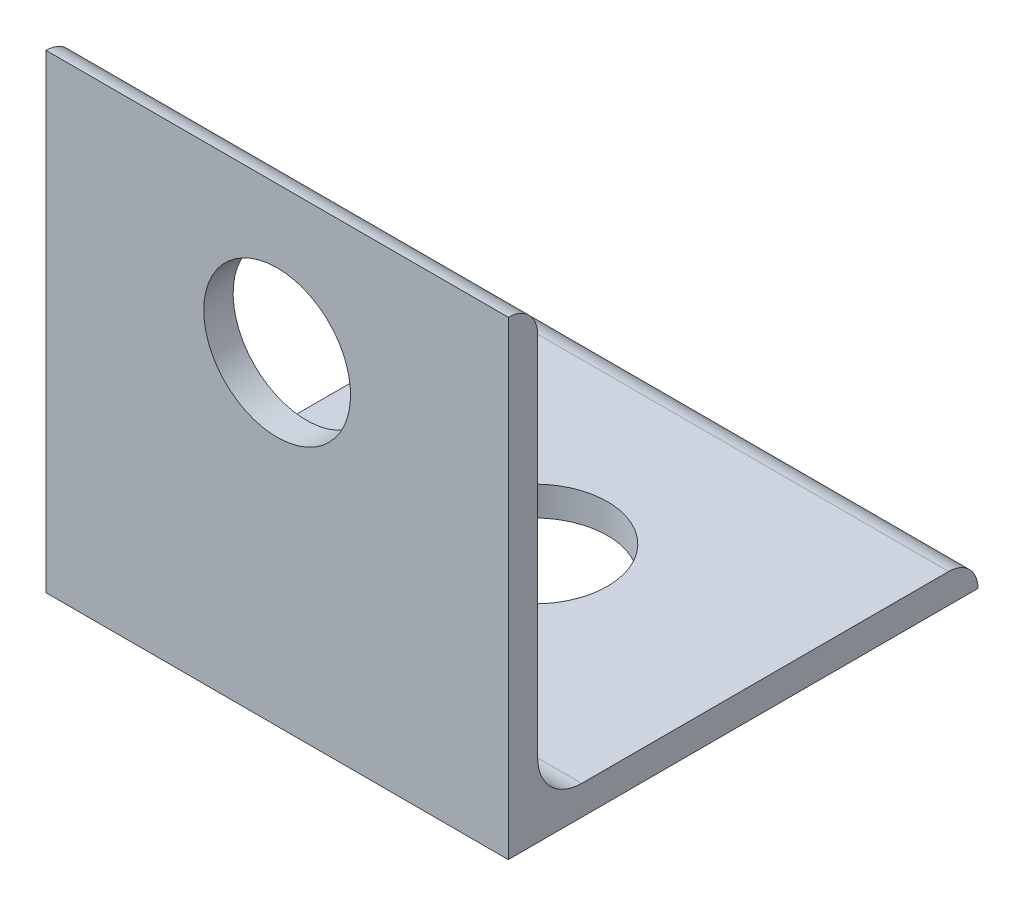
from build123d import *

# Parameters (mm, degrees)
ANGLE_IRON_2_X_2_X_0_125_1_DEPTH = 50
SKETCH4_R                        = 7.9375
CUT_EXTRUDE1_DEPTH               = 3.175
SKETCH3_R                        = 7.9375
CUT_EXTRUDE2_DEPTH               = 3.175


with BuildPart() as part:
    # Sketch1 → Angle iron 2 X 2 X 0.125(1) (new body)
    with BuildSketch(Plane(origin=(0, 0, 0), x_dir=(0, 0, -1), z_dir=(1, 0, 0))):
        with BuildLine():
            Line((0, 0), (0, 50.8))
            Line((0, 50.8), (0.00508, 50.8))
            ThreePointArc((0.00508, 50.8), (2.246551928, 49.871551928), (3.175, 47.63008))
            Line((3.175, 47.63008), (3.175, 7.9375))
            ThreePointArc((3.175, 7.9375), (4.569903955, 4.569903955), (7.9375, 3.175))
            Line((7.9375, 3.175), (47.63008, 3.175))
            ThreePointArc((47.63008, 3.175), (49.871551928, 2.246551928), (50.8, 0.00508))
            Line((50.8, 0.00508), (50.8, 0))
            Line((50.8, 0), (0, 0))
        make_face()
    extrude(amount=ANGLE_IRON_2_X_2_X_0_125_1_DEPTH)

    # Sketch4 → Cut-Extrude1 (cut)
    with BuildSketch(Plane(origin=(0, 3.175, 0), x_dir=(1, 0, 0), z_dir=(0, 1, 0))):
        with Locations(Location((25, 27.78379, 0), (0, 0, 270))):
            Circle(SKETCH4_R)
    extrude(amount=-CUT_EXTRUDE1_DEPTH, mode=Mode.SUBTRACT)

    # Sketch3 → Cut-Extrude2 (cut)
    with BuildSketch(Plane(origin=(0, 0, -3.175), x_dir=(-1, 0, 0), z_dir=(0, 0, -1))):
        with Locations(Location((-25, 34.9975, 0), (0, 0, 90))):
            Circle(SKETCH3_R)
    extrude(amount=-CUT_EXTRUDE2_DEPTH, mode=Mode.SUBTRACT)


solid = part.part
